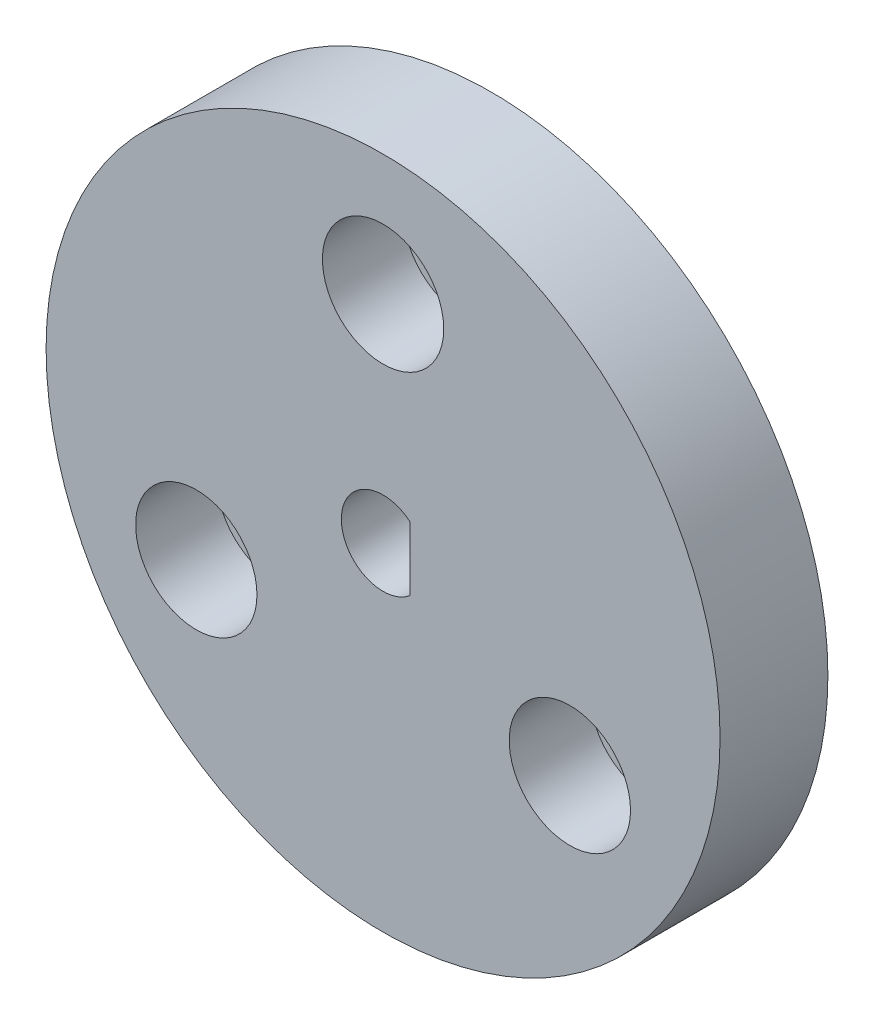
from build123d import *

# Parameters (mm, degrees)
SKETCH_1_R               = 3
SKETCH_1_R_2             = 1.65
EXTRUDE_1_DEPTH          = 4
CUT_EXTRUDE_2_DEPTH      = 6.830951895
PATTERN_CIRCULAR_1_COUNT = 9
SKETCH_2_R               = 5
EXTRUDE_2_DEPTH          = 4
SKETCH_3_R               = 12.5
SKETCH_3_R_2             = 1.5
SKETCH_3_R_3             = 5
EXTRUDE_4_DEPTH          = 4
CUT_EXTRUDE_START        = 4
SKETCH_3_3_R             = 2.25
CUT_EXTRUDE_3_DEPTH      = 3
CUT_EXTRUDE_4_DEPTH      = 19.12456896


with BuildPart() as part:
    # 草图1 → 凸台-拉伸1 (new body)
    with BuildSketch(Plane.XY):
        Circle(SKETCH_1_R)
        Circle(SKETCH_1_R_2, mode=Mode.SUBTRACT)
    extrude(amount=EXTRUDE_1_DEPTH)

    # 草图1<3> → 切除-拉伸2 (cut, through all)
    with BuildSketch(Plane.XY):
        with BuildLine():
            Line((1.583201231, 0.595370355), (1.54440693, 0.580781573))
            ThreePointArc((1.54440693, 0.580781573), (1.623387112, 0.295151288), (1.65, 0))
            ThreePointArc((1.65, 0), (1.623387112, -0.295151288), (1.54440693, -0.580781573))
            Line((1.54440693, -0.580781573), (1.583201231, -0.595370355))
            add(Edge.make_bspline(
                [(1.583201231, -0.595370355), (1.595268082, -0.599908151), (1.629927649, -0.609960022), (1.698544644, -0.618780808), (1.810680065, -0.617601716), (1.954246735, -0.59352555), (2.132298369, -0.536822163), (2.302941373, -0.452472776), (2.42578745, -0.372108406), (2.505673341, -0.310927028), (2.533645284, -0.288342805)],
                knots=[0, 0, 0, 0, 0, 0.005604068, 0.015718248, 0.029959916, 0.048733667, 0.068727063, 0.096888892, 0.112551479, 0.112551479, 0.112551479, 0.112551479, 0.112551479], degree=4))
            ThreePointArc((2.533645284, -0.288342805), (2.545908038, -0.144403125), (2.55, 0))
            ThreePointArc((2.55, 0), (2.545908038, 0.144403125), (2.533645284, 0.288342805))
            add(Edge.make_bspline(
                [(1.583201231, 0.595370355), (1.595268082, 0.599908151), (1.629927649, 0.609960022), (1.698544644, 0.618780808), (1.810680065, 0.617601716), (1.954246735, 0.59352555), (2.132298369, 0.536822163), (2.302941373, 0.452472776), (2.42578745, 0.372108406), (2.505673341, 0.310927028), (2.533645284, 0.288342805)],
                knots=[0, 0, 0, 0, 0, 0.005604068, 0.015718248, 0.029959916, 0.048733667, 0.068727063, 0.096888892, 0.112551479, 0.112551479, 0.112551479, 0.112551479, 0.112551479], degree=4))
        make_face()
    cut_extrude_2 = extrude(amount=CUT_EXTRUDE_2_DEPTH, mode=Mode.SUBTRACT)

    # 阵列(圆周)1: 切除-拉伸2 ×9 about axis
    pattern_circular_1_axis = Axis((0, 0, 4), (0, 0, 1))
    for i in range(1, PATTERN_CIRCULAR_1_COUNT):
        add(cut_extrude_2.rotate(pattern_circular_1_axis, i * 360 / PATTERN_CIRCULAR_1_COUNT), mode=Mode.SUBTRACT)

    # 草图2 → 凸台-拉伸2 (add)
    with BuildSketch(Plane(origin=(0, 0, 0), x_dir=(-1, 0, 0), z_dir=(0, 0, -1))):
        Circle(SKETCH_2_R)
    extrude(amount=-EXTRUDE_2_DEPTH)

    # 草图3 → 凸台-拉伸4 (add)
    with BuildSketch(Plane.XY):
        Circle(SKETCH_3_R)
        with Locations((0, 8)):
            Circle(SKETCH_3_R_2, mode=Mode.SUBTRACT)
        with Locations((6.92820323, -4)):
            Circle(SKETCH_3_R_2, mode=Mode.SUBTRACT)
        with Locations((-6.92820323, -4)):
            Circle(SKETCH_3_R_2, mode=Mode.SUBTRACT)
        Circle(SKETCH_3_R_3, mode=Mode.SUBTRACT)
    extrude(amount=EXTRUDE_4_DEPTH)

    # 草图3<3> → 切除-拉伸3 (cut)
    with BuildSketch(Plane.XY.offset(CUT_EXTRUDE_START)):
        with Locations((0, 8)):
            Circle(SKETCH_3_3_R)
        with Locations((6.92820323, -4)):
            Circle(SKETCH_3_3_R)
        with Locations((-6.92820323, -4)):
            Circle(SKETCH_3_3_R)
    extrude(amount=-CUT_EXTRUDE_3_DEPTH, mode=Mode.SUBTRACT)

    # 草图4 → 切除-拉伸4 (cut, through all)
    with BuildSketch(Plane.XY.offset(4)):
        with BuildLine():
            ThreePointArc((1, 1.184271928), (-1.55, 0), (1, -1.184271928))
            Line((1, -1.184271928), (1, 1.184271928))
        make_face()
    extrude(amount=-CUT_EXTRUDE_4_DEPTH, mode=Mode.SUBTRACT)


solid = part.part
